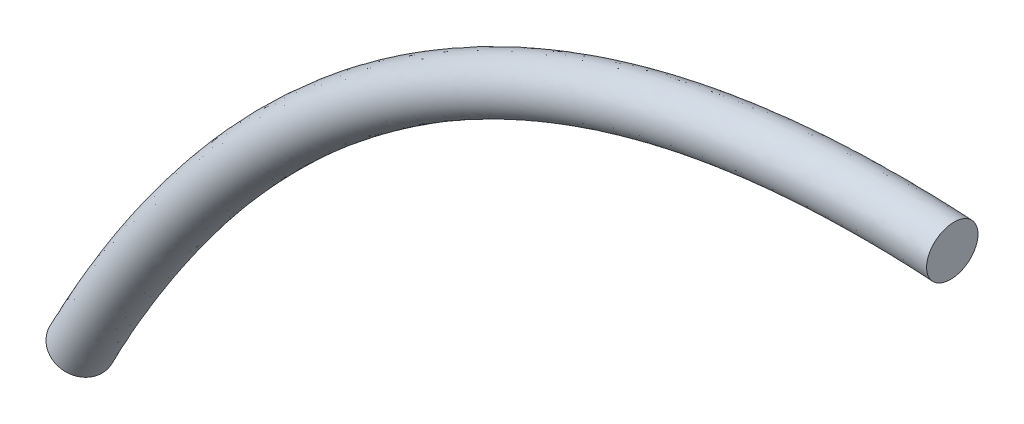
from build123d import *

# Parameters (mm, degrees)
SWEEP1_PROFILE_R = 4.699


with BuildPart() as part:
    # Sweep1: sweep along a curve in space
    with BuildLine() as sweep1_path:
        add(Edge.make_bspline(
            [(-244.225633911, -166.510690166, 163.32176145), (-172.691022825, -46.863058052, 181.81588183), (-66.61351475, -53.682436204, 181.6608)],
            knots=[0, 0, 0, 1, 1, 1], degree=2))
    # Sweep1 profile (on start of the path) → Sweep1 (sweep)
    with BuildSketch(Plane(origin=(-244.225633911, -166.510690166, 163.32176145), x_dir=(0.8582956357480714, -0.5131555335917306, 0), z_dir=(0.5086983065679163, 0.85084055000574, 0.13151574567656996))):
        Circle(SWEEP1_PROFILE_R)
    sweep(path=sweep1_path.line)


solid = part.part
